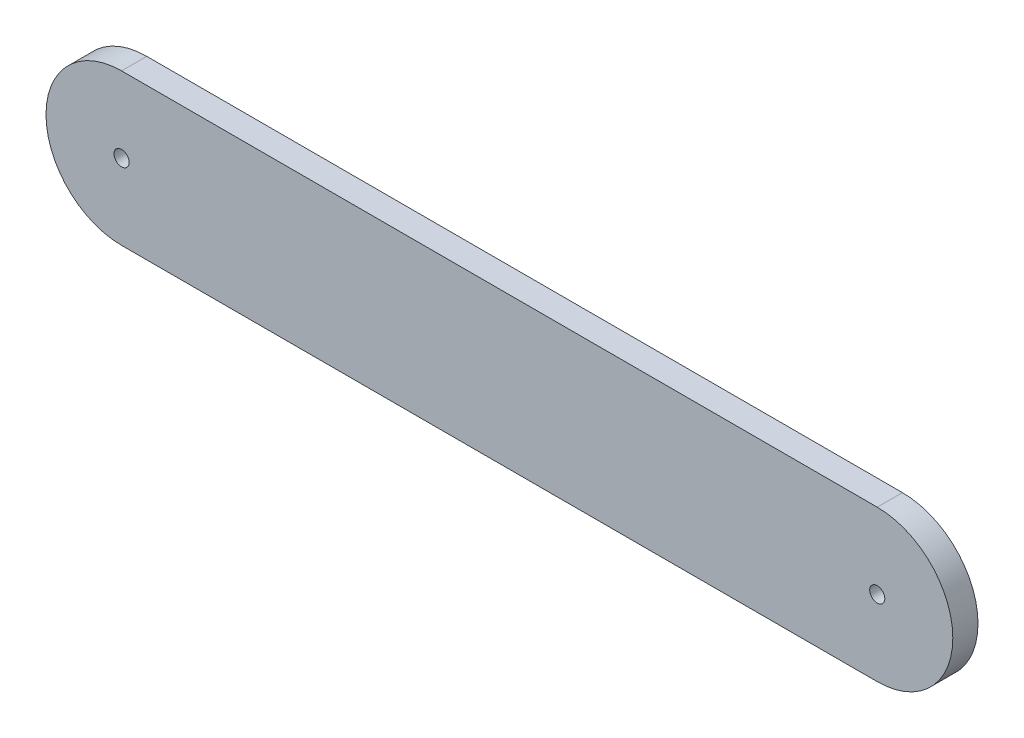
from build123d import *

# Parameters (mm, degrees)
BOSS_EXTRUDE1_DEPTH = 5
SKETCH4_R           = 1.5
CUT_EXTRUDE1_DEPTH  = 5


with BuildPart() as part:
    # Sketch2 → Boss-Extrude1 (new body)
    with BuildSketch(Plane.XY):
        with BuildLine():
            Line((-75, 15), (75, 15))
            ThreePointArc((75, 15), (90, 0), (75, -15))
            Line((75, -15), (-75, -15))
            ThreePointArc((-75, -15), (-90, 0), (-75, 15))
        make_face()
    extrude(amount=BOSS_EXTRUDE1_DEPTH)

    # Sketch4 → Cut-Extrude1 (cut)
    with BuildSketch(Plane(origin=(0, 0, 0), x_dir=(-1, 0, 0), z_dir=(0, 0, -1))):
        with Locations((-75, 0)):
            Circle(SKETCH4_R)
        with Locations((75, 0)):
            Circle(SKETCH4_R)
    extrude(amount=-CUT_EXTRUDE1_DEPTH, mode=Mode.SUBTRACT)


solid = part.part
